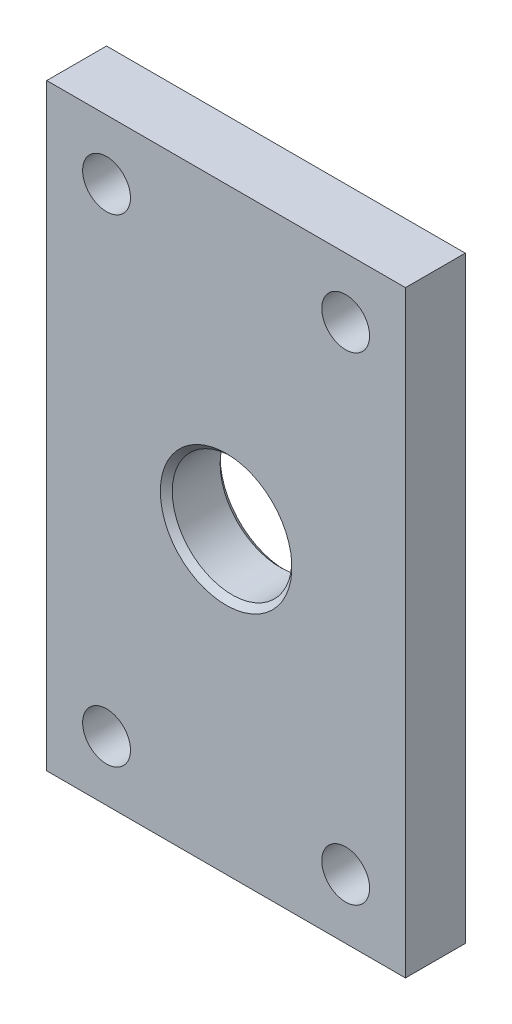
from build123d import *

# Parameters (mm, degrees)
SKETCH1_W           = 100
SKETCH1_H           = 60
BOSS_EXTRUDE1_DEPTH = 5
CUT_EXTRUDE2_START  = -5
SKETCH2_R           = 4
CUT_EXTRUDE2_DEPTH  = 10
CUT_EXTRUDE4_START  = -5
SKETCH3_R           = 4
CUT_EXTRUDE4_DEPTH  = 10
CUT_EXTRUDE6_START  = -5
SKETCH4_R           = 10
CUT_EXTRUDE6_DEPTH  = 10
CHAMFER1_SIZE       = 1


with BuildPart() as part:
    # Sketch1 → Boss-Extrude1 (new, symmetric)
    with BuildSketch(Plane(origin=(0, 0, 0), x_dir=(0, 1, 0), z_dir=(0, 0, 1))):
        Rectangle(SKETCH1_W, SKETCH1_H)
    extrude(amount=BOSS_EXTRUDE1_DEPTH, both=True)

    # Sketch2 → Cut-Extrude2 (cut)
    with BuildSketch(Plane(origin=(0, 0, 0), x_dir=(0, 1, 0), z_dir=(0, 0, 1)).offset(CUT_EXTRUDE2_START)):
        with Locations(Location((-40, -20, 0), (0, 0, 270))):
            Circle(SKETCH2_R)
    extrude(amount=CUT_EXTRUDE2_DEPTH, mode=Mode.SUBTRACT)

    # Sketch3 → Cut-Extrude4 (cut)
    with BuildSketch(Plane(origin=(0, 0, 0), x_dir=(0, 1, 0), z_dir=(0, 0, 1)).offset(CUT_EXTRUDE4_START)):
        with Locations(Location((40, -20, 0), (0, 0, 270))):
            Circle(SKETCH3_R)
        with Locations(Location((-40, 20, 0), (0, 0, 270))):
            Circle(SKETCH3_R)
        with Locations(Location((40, 20, 0), (0, 0, 270))):
            Circle(SKETCH3_R)
    extrude(amount=CUT_EXTRUDE4_DEPTH, mode=Mode.SUBTRACT)

    # Sketch4 → Cut-Extrude6 (cut)
    with BuildSketch(Plane(origin=(0, 0, 0), x_dir=(0, 1, 0), z_dir=(0, 0, 1)).offset(CUT_EXTRUDE6_START)):
        with Locations(Location((0, 0, 0), (0, 0, 270))):
            Circle(SKETCH4_R)
    extrude(amount=CUT_EXTRUDE6_DEPTH, mode=Mode.SUBTRACT)

    # Chamfer1
    chamfer1_edges = [part.edges().sort_by_distance(p)[0] for p in [
        (-10, 0, -5),
        (-10, 0, 5),
    ]]
    chamfer(chamfer1_edges, length=CHAMFER1_SIZE)


solid = part.part
